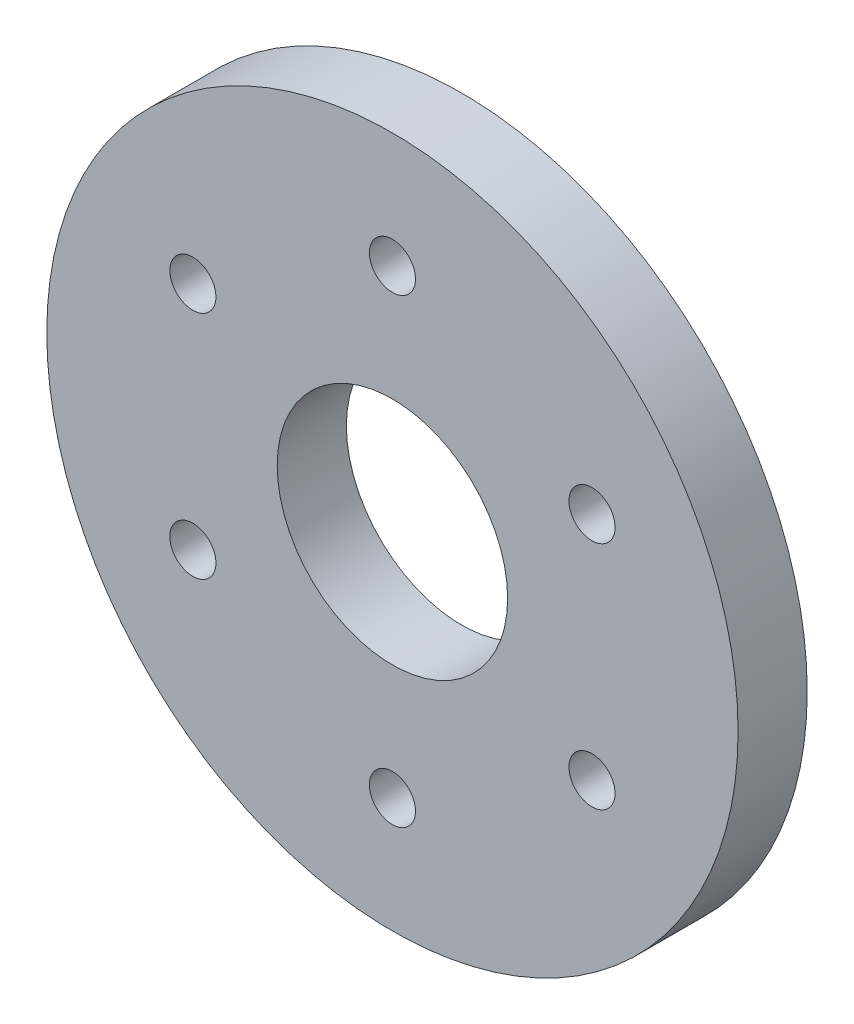
from build123d import *

# Parameters (mm, degrees)
SKETCH1_R           = 30
SKETCH1_R_2         = 10
SKETCH1_R_3         = 2
BOSS_EXTRUDE1_DEPTH = 6


with BuildPart() as part:
    # Sketch1 → Boss-Extrude1 (new body)
    with BuildSketch(Plane.XY):
        Circle(SKETCH1_R)
        Circle(SKETCH1_R_2, mode=Mode.SUBTRACT)
        with Locations((0, 20)):
            Circle(SKETCH1_R_3, mode=Mode.SUBTRACT)
        with Locations((17.320508076, 10)):
            Circle(SKETCH1_R_3, mode=Mode.SUBTRACT)
        with Locations((17.320508076, -10)):
            Circle(SKETCH1_R_3, mode=Mode.SUBTRACT)
        with Locations((0, -20)):
            Circle(SKETCH1_R_3, mode=Mode.SUBTRACT)
        with Locations((-17.320508076, -10)):
            Circle(SKETCH1_R_3, mode=Mode.SUBTRACT)
        with Locations((-17.320508076, 10)):
            Circle(SKETCH1_R_3, mode=Mode.SUBTRACT)
    extrude(amount=BOSS_EXTRUDE1_DEPTH)


solid = part.part
